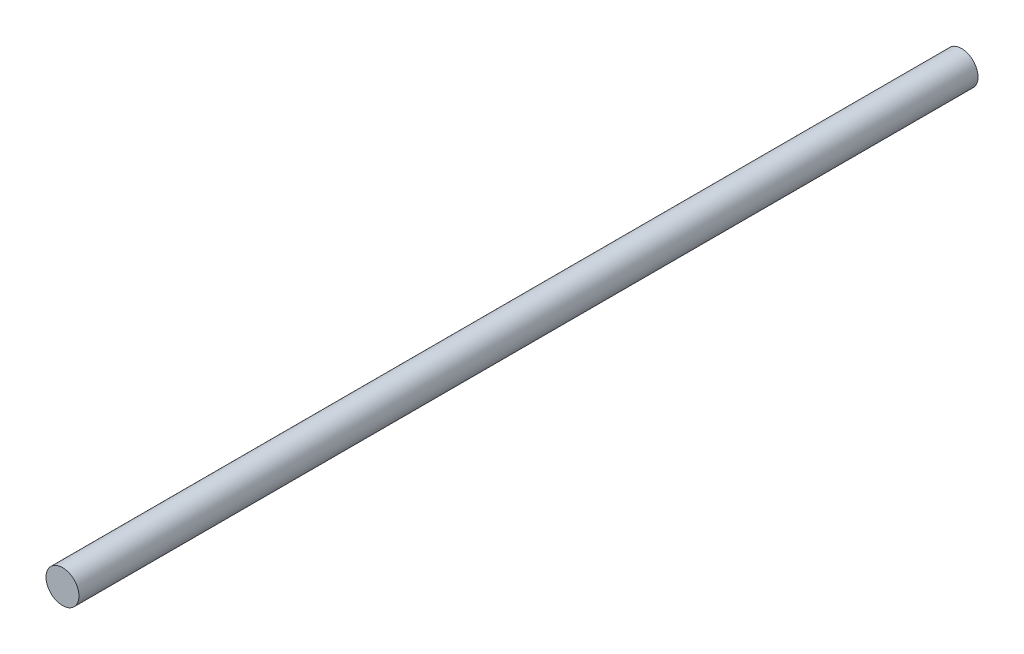
from build123d import *

# Parameters (mm, degrees)
ESQUISSE1_R        = 4
BOSS_EXTRU_1_DEPTH = 218.26


with BuildPart() as part:
    # Esquisse1 → Boss.-Extru.1 (new body)
    with BuildSketch(Plane.XY):
        with Locations(Location((0, 0, 0), (0, 0, 180))):
            Circle(ESQUISSE1_R)
    extrude(amount=BOSS_EXTRU_1_DEPTH)


solid = part.part
